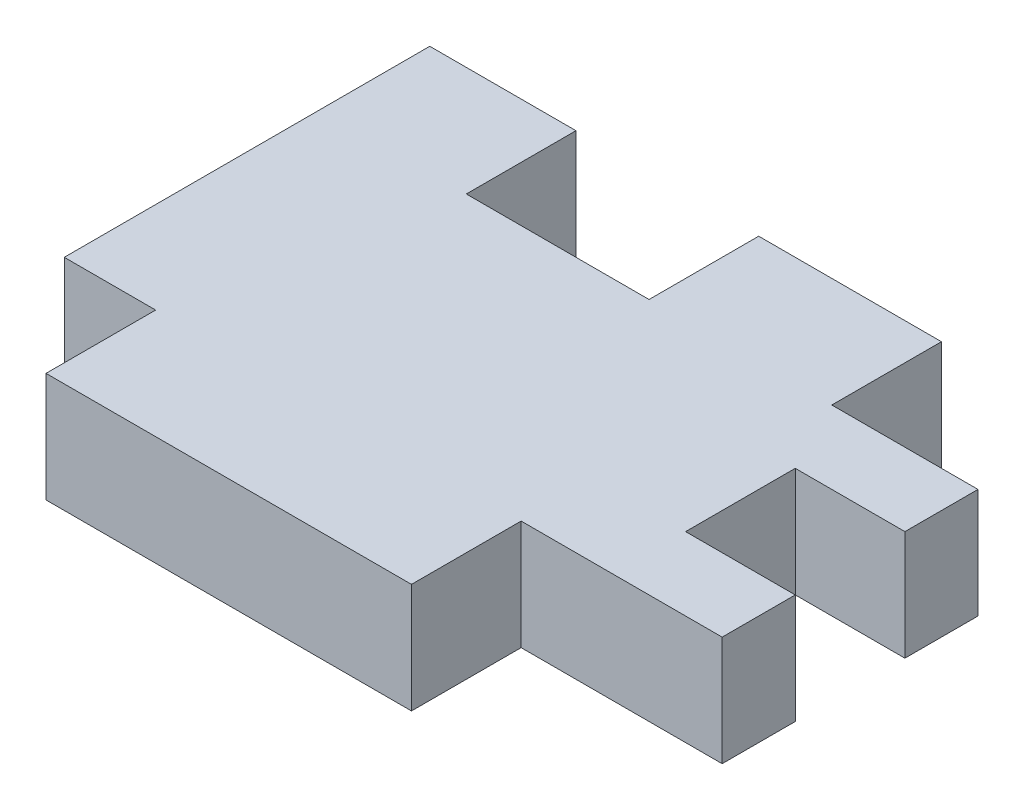
from build123d import *

# Parameters (mm, degrees)
CROQUIS1_W              = 5
CROQUIS1_H              = 3
SALIENTE_EXTRUIR1_DEPTH = 3


with BuildPart() as part:
    # Croquis1 → Saliente-Extruir1 (new body)
    with BuildSketch(Plane(origin=(0, 0, 0), x_dir=(1, 0, 0), z_dir=(0, 1, 0))):
        Polygon((4, 10), (4, 13), (0, 13), (0, 3), (2.5, 3), (2.5, 0), (12.5, 0), (12.5, 3), (18, 3), (18, 5), (15, 5), (15, 6.5), (15, 8), (18, 8), (18, 10), (14, 10), (9, 10), align=None)
        with Locations((11.5, 11.5)):
            Rectangle(CROQUIS1_W, CROQUIS1_H)
    extrude(amount=SALIENTE_EXTRUIR1_DEPTH)


solid = part.part
